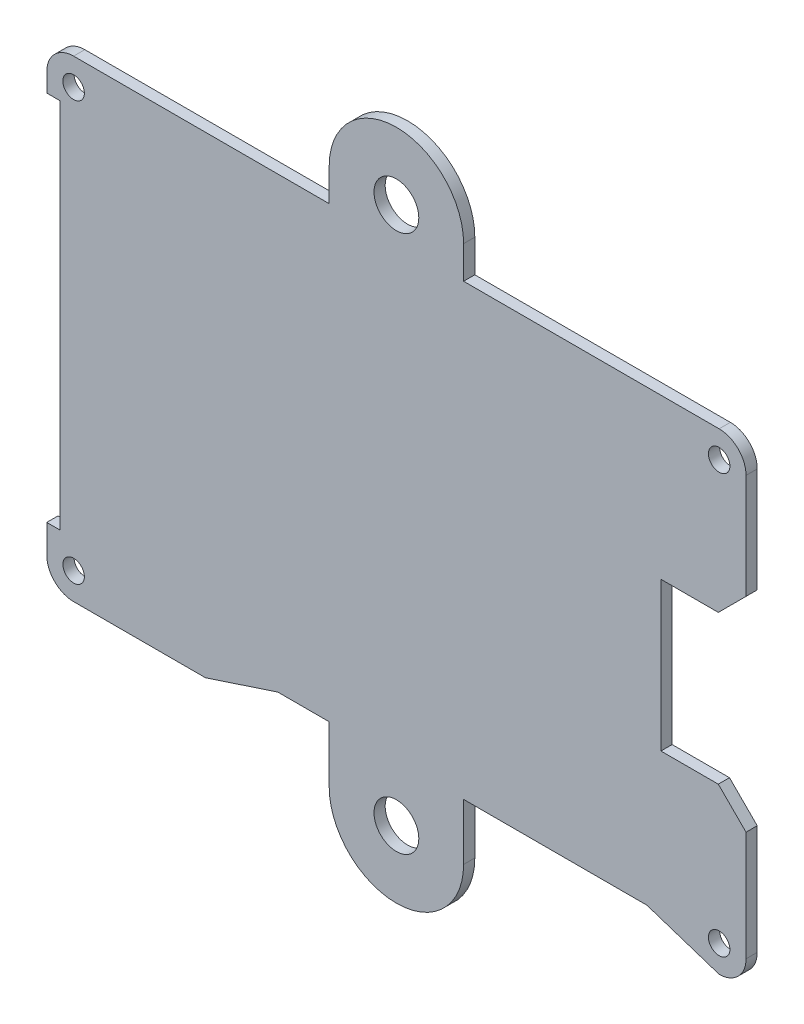
from build123d import *

# Parameters (mm, degrees)
SKETCH1_R           = 1.355900406
BOSS_EXTRUDE1_DEPTH = 1.5875
SKETCH2_R           = 3.175
BOSS_EXTRUDE2_DEPTH = 1.5875
SKETCH3_R           = 1.524
CUT_EXTRUDE1_DEPTH  = 436.184338179
CUT_EXTRUDE2_DEPTH  = 436.184338179
SKETCH5_W           = 2.0955
SKETCH5_H           = 13.208
BOSS_EXTRUDE3_DEPTH = 1.5875


with BuildPart() as part:
    # Sketch1 → Boss-Extrude1 (new body)
    with BuildSketch(Plane.XY):
        with BuildLine():
            Line((-301.9473, 111.74645), (-305.87795, 115.6771))
            Line((-305.87795, 115.6771), (-316.1078, 115.6771))
            Line((-316.1078, 115.6771), (-316.1078, 128.8851))
            Line((-316.1078, 128.8851), (-305.87795, 128.8851))
            Line((-305.87795, 128.8851), (-301.9473, 132.81575))
            Line((-301.9473, 132.81575), (-301.9473, 150.9704))
            ThreePointArc((-301.9473, 150.9704), (-303.063223164, 153.664476836), (-305.7573, 154.7804))
            Line((-305.7573, 154.7804), (-397.247125, 154.7804))
            ThreePointArc((-397.247125, 154.7804), (-399.946077222, 153.659592612), (-401.0571, 150.956597849))
            Line((-401.0571, 150.956597849), (-401.0571, 148.341))
            Line((-401.0571, 148.341), (-399.1521, 148.341))
            Line((-399.1521, 148.341), (-399.1521, 95.6449))
            Line((-399.1521, 95.6449), (-401.0571, 95.6449))
            Line((-401.0571, 95.6449), (-401.0571, 91.659304166))
            ThreePointArc((-401.0571, 91.659304166), (-399.951018769, 88.947400452), (-397.2472, 87.8217))
            Line((-397.2472, 87.8217), (-378.5565, 87.8217))
            Line((-378.5565, 87.8217), (-368.3165, 91.1883))
            Line((-368.3165, 91.1883), (-315.9973, 91.1883))
            Line((-315.9973, 91.1883), (-305.7573, 87.8217))
            ThreePointArc((-305.7573, 87.8217), (-303.063223164, 88.937623164), (-301.9473, 91.6317))
            Line((-301.9473, 91.6317), (-301.9473, 111.74645))
        make_face()
        with Locations((-305.7573, 91.6317)):
            Circle(SKETCH1_R, mode=Mode.SUBTRACT)
        with Locations((-305.7573, 150.9704)):
            Circle(SKETCH1_R, mode=Mode.SUBTRACT)
        with Locations((-397.247125, 150.9704)):
            Circle(SKETCH1_R, mode=Mode.SUBTRACT)
        with Locations((-397.2472, 91.6317)):
            Circle(SKETCH1_R, mode=Mode.SUBTRACT)
    extrude(amount=BOSS_EXTRUDE1_DEPTH)

    # Sketch2 → Boss-Extrude2 (add)
    # profile 1 of 2: a face of its own
    with BuildSketch(Plane.XY.offset(1.5875)):
        with BuildLine():
            Line((-361.0272, 159.40105), (-361.0272, 154.7804))
            Line((-361.0272, 154.7804), (-341.9772, 154.7804))
            Line((-341.9772, 154.7804), (-341.9772, 159.40105))
            ThreePointArc((-341.9772, 159.40105), (-351.5022, 168.92605), (-361.0272, 159.40105))
        make_face()
        with Locations((-351.5022, 159.40105)):
            Circle(SKETCH2_R, mode=Mode.SUBTRACT)
    # profile 2 of 2: a face of its own
    with BuildSketch(Plane.XY.offset(1.5875)):
        with BuildLine():
            Line((-341.9772, 91.1883), (-361.0272, 91.1883))
            Line((-361.0272, 91.1883), (-361.0272, 83.20105))
            ThreePointArc((-361.0272, 83.20105), (-351.5022, 73.67605), (-341.9772, 83.20105))
            Line((-341.9772, 83.20105), (-341.9772, 91.1883))
        make_face()
        with Locations((-351.5022, 83.20105)):
            Circle(SKETCH2_R, mode=Mode.SUBTRACT)
    extrude(amount=-BOSS_EXTRUDE2_DEPTH)

    # Sketch3 → Cut-Extrude1 (cut, through all)
    with BuildSketch(Plane.XY.offset(1.5875)):
        with Locations((-397.247125, 150.9704)):
            Circle(SKETCH3_R)
        with Locations((-305.7573, 150.9704)):
            Circle(SKETCH3_R)
        with Locations((-305.7573, 91.6317)):
            Circle(SKETCH3_R)
        with Locations((-397.2472, 91.6317)):
            Circle(SKETCH3_R)
    extrude(amount=-CUT_EXTRUDE1_DEPTH, mode=Mode.SUBTRACT)

    # Sketch4 → Cut-Extrude2 (cut, through all)
    with BuildSketch(Plane.XY.offset(1.5875)):
        Polygon((-301.9473, 136.11775), (-305.87795, 132.1871), (-314.0123, 132.1871), (-314.0123, 111.1051), (-305.87795, 111.1051), (-301.9473, 107.17445), align=None)
    extrude(amount=-CUT_EXTRUDE2_DEPTH, mode=Mode.SUBTRACT)

    # Sketch5 → Boss-Extrude3 (add)
    with BuildSketch(Plane.XY.offset(1.5875)):
        with Locations((-315.06005, 122.2811)):
            Rectangle(SKETCH5_W, SKETCH5_H)
    extrude(amount=-BOSS_EXTRUDE3_DEPTH)


solid = part.part
